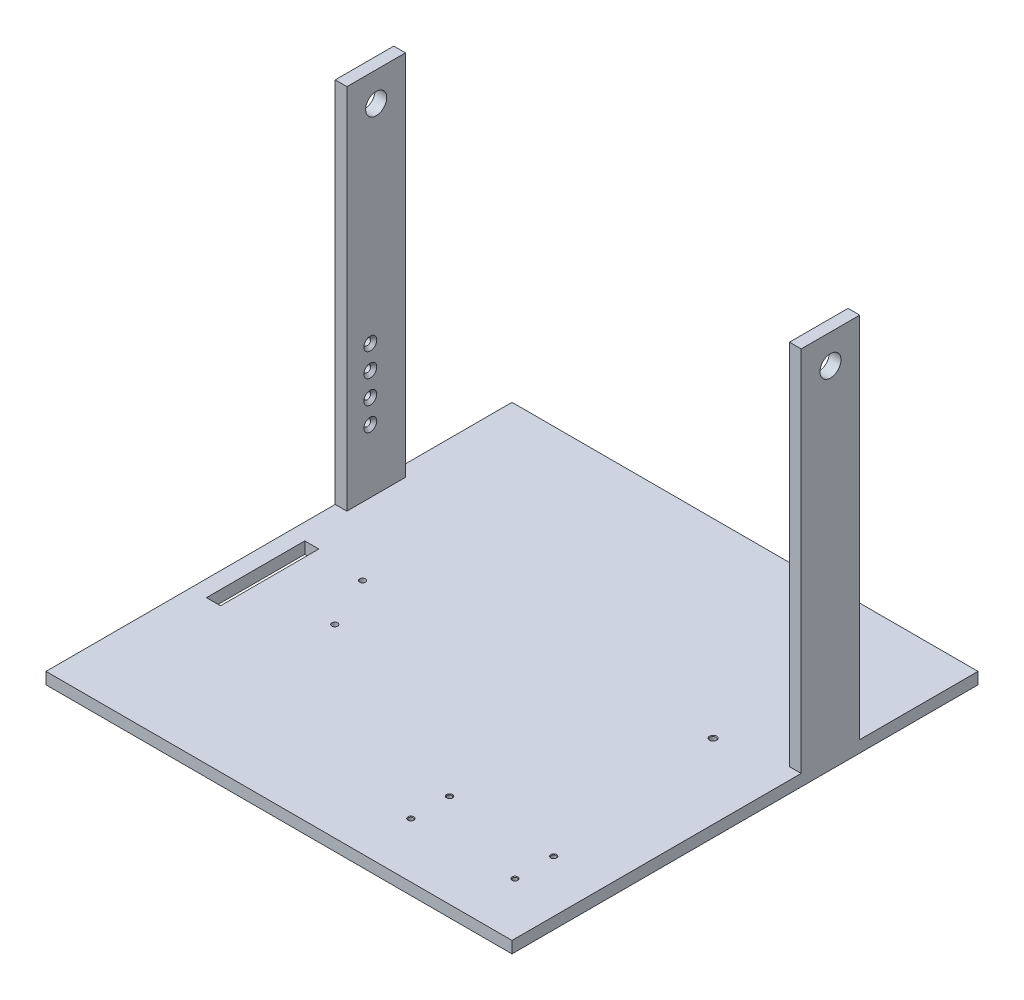
from build123d import *

# Parameters (mm, degrees)
SKETCH1_W                                         = 199
SKETCH1_H                                         = 199
BOSS_EXTRUDE1_DEPTH                               = 5
SKETCH2_W                                         = 5
SKETCH2_H                                         = 25
BOSS_EXTRUDE2_DEPTH                               = 18.8
SKETCH3_W                                         = 5
SKETCH3_H                                         = 25
BOSS_EXTRUDE3_DEPTH                               = 46.4
SKETCH4_W                                         = 5
SKETCH4_H                                         = 25
BOSS_EXTRUDE4_DEPTH                               = 91.8
SKETCH5_W                                         = 5
SKETCH5_H                                         = 25
BOSS_EXTRUDE5_DEPTH                               = 157
SKETCH6_R                                         = 4.5
CUT_EXTRUDE1_DEPTH                                = 325.724498614
SKETCH12_W                                        = 6
SKETCH12_H                                        = 42
CUT_EXTRUDE3_DEPTH                                = 5
M3X0_5_TAPPED_HOLE1_D                             = 2.5
M3X0_5_TAPPED_HOLE1_DEPTH                         = 4
M3X0_5_TAPPED_HOLE1_TIP                           = 0.751075774
CSK_FOR_M2_5_FLAT_HEAD_MACHINE_SCREW1_D           = 2.9
CSK_FOR_M2_5_FLAT_HEAD_MACHINE_SCREW1_DEPTH       = 5
CSK_FOR_M2_5_FLAT_HEAD_MACHINE_SCREW1_CSINK_D     = 5.5
CSK_FOR_M2_5_FLAT_HEAD_MACHINE_SCREW1_CSINK_ANGLE = 90
M2_5X0_45_TAPPED_HOLE1_D                          = 2.05
M2_5X0_45_TAPPED_HOLE1_DEPTH                      = 4
M2_5X0_45_TAPPED_HOLE1_CSINK_D                    = 2.55
M2_5X0_45_TAPPED_HOLE1_CSINK_ANGLE                = 90
M2_5X0_45_TAPPED_HOLE1_TIP                        = 0.615882135
M3X0_5_TAPPED_HOLE2_D                             = 2.5
M3X0_5_TAPPED_HOLE2_DEPTH                         = 4.3
M3X0_5_TAPPED_HOLE2_CSINK_D                       = 3.05
M3X0_5_TAPPED_HOLE2_CSINK_ANGLE                   = 90
M3X0_5_TAPPED_HOLE2_TIP                           = 0.751075774


with BuildPart() as part:
    # Sketch1 → Boss-Extrude1 (new body)
    with BuildSketch(Plane(origin=(0, 0, 0), x_dir=(1, 0, 0), z_dir=(0, 1, 0))):
        with Locations((99.5, -99.5)):
            Rectangle(SKETCH1_W, SKETCH1_H)
    extrude(amount=BOSS_EXTRUDE1_DEPTH)

    # Sketch2 → Boss-Extrude2 (add)
    with BuildSketch(Plane(origin=(0, 5, 0), x_dir=(1, 0, 0), z_dir=(0, 1, 0))):
        with Locations((2.5, -63)):
            Rectangle(SKETCH2_W, SKETCH2_H)
    extrude(amount=BOSS_EXTRUDE2_DEPTH)

    # Sketch3 → Boss-Extrude3 (add)
    with BuildSketch(Plane(origin=(0, 23.8, 0), x_dir=(1, 0, 0), z_dir=(0, 1, 0))):
        with Locations((2.5, -63)):
            Rectangle(SKETCH3_W, SKETCH3_H)
    extrude(amount=BOSS_EXTRUDE3_DEPTH)

    # Sketch4 → Boss-Extrude4 (add)
    with BuildSketch(Plane(origin=(0, 70.2, 0), x_dir=(1, 0, 0), z_dir=(0, 1, 0))):
        with Locations((2.5, -63)):
            Rectangle(SKETCH4_W, SKETCH4_H)
    extrude(amount=BOSS_EXTRUDE4_DEPTH)

    # Sketch5 → Boss-Extrude5 (add)
    with BuildSketch(Plane(origin=(0, 5, 0), x_dir=(1, 0, 0), z_dir=(0, 1, 0))):
        with Locations((196.5, -63)):
            Rectangle(SKETCH5_W, SKETCH5_H)
    extrude(amount=BOSS_EXTRUDE5_DEPTH)

    # Sketch6 → Cut-Extrude1 (cut, through all)
    with BuildSketch(Plane.ZY):
        with Locations((63, 149.5)):
            Circle(SKETCH6_R)
    extrude(amount=-CUT_EXTRUDE1_DEPTH, mode=Mode.SUBTRACT)

    # Sketch12 → Cut-Extrude3 (cut)
    with BuildSketch(Plane(origin=(0, 5, 0), x_dir=(1, 0, 0), z_dir=(0, 1, 0))):
        with Locations((10, -116.5)):
            Rectangle(SKETCH12_W, SKETCH12_H)
    extrude(amount=-CUT_EXTRUDE3_DEPTH, mode=Mode.SUBTRACT)

    # M3x0.5 Tapped Hole1
    with Locations(Plane(origin=(0, 5, 0), x_dir=(1, 0, 0), z_dir=(0, 1, 0))):
        with Locations((34, -97.8), (44.31875, -120)):
            Hole(M3X0_5_TAPPED_HOLE1_D / 2, depth=M3X0_5_TAPPED_HOLE1_DEPTH)
            with Locations((0, 0, -(M3X0_5_TAPPED_HOLE1_DEPTH + M3X0_5_TAPPED_HOLE1_TIP / 2))):  # 118° drill point
                Cone(0, M3X0_5_TAPPED_HOLE1_D / 2, M3X0_5_TAPPED_HOLE1_TIP, mode=Mode.SUBTRACT)

    # CSK for M2.5 Flat Head Machine Screw1
    with Locations(Plane(origin=(5, 62, 65.5), x_dir=(0, 0, 1), z_dir=(1, 0, 0))):
        with Locations((0, 0), (0, 10), (0, 20), (0, 30)):
            CounterSinkHole(CSK_FOR_M2_5_FLAT_HEAD_MACHINE_SCREW1_D / 2, CSK_FOR_M2_5_FLAT_HEAD_MACHINE_SCREW1_CSINK_D / 2, depth=CSK_FOR_M2_5_FLAT_HEAD_MACHINE_SCREW1_DEPTH, counter_sink_angle=CSK_FOR_M2_5_FLAT_HEAD_MACHINE_SCREW1_CSINK_ANGLE)

    # M2.5x0.45 Tapped Hole1
    with Locations(Plane(origin=(0, 5, 0), x_dir=(1, 0, 0), z_dir=(0, 1, 0))):
        with Locations((132.323297508, -175.500631971), (132.323297508, -158.999368029), (176.776702492, -158.999368029), (176.776702492, -175.500631971)):
            CounterSinkHole(M2_5X0_45_TAPPED_HOLE1_D / 2, M2_5X0_45_TAPPED_HOLE1_CSINK_D / 2, depth=M2_5X0_45_TAPPED_HOLE1_DEPTH, counter_sink_angle=M2_5X0_45_TAPPED_HOLE1_CSINK_ANGLE)
            with Locations((0, 0, -(M2_5X0_45_TAPPED_HOLE1_DEPTH + M2_5X0_45_TAPPED_HOLE1_TIP / 2))):  # 118° drill point
                Cone(0, M2_5X0_45_TAPPED_HOLE1_D / 2, M2_5X0_45_TAPPED_HOLE1_TIP, mode=Mode.SUBTRACT)

    # M3x0.5 Tapped Hole2
    with Locations(Plane(origin=(0, 5, 0), x_dir=(1, 0, 0), z_dir=(0, 1, 0))):
        with Locations((167.156, -81.28)):
            CounterSinkHole(M3X0_5_TAPPED_HOLE2_D / 2, M3X0_5_TAPPED_HOLE2_CSINK_D / 2, depth=M3X0_5_TAPPED_HOLE2_DEPTH, counter_sink_angle=M3X0_5_TAPPED_HOLE2_CSINK_ANGLE)
            with Locations((0, 0, -(M3X0_5_TAPPED_HOLE2_DEPTH + M3X0_5_TAPPED_HOLE2_TIP / 2))):  # 118° drill point
                Cone(0, M3X0_5_TAPPED_HOLE2_D / 2, M3X0_5_TAPPED_HOLE2_TIP, mode=Mode.SUBTRACT)


solid = part.part
